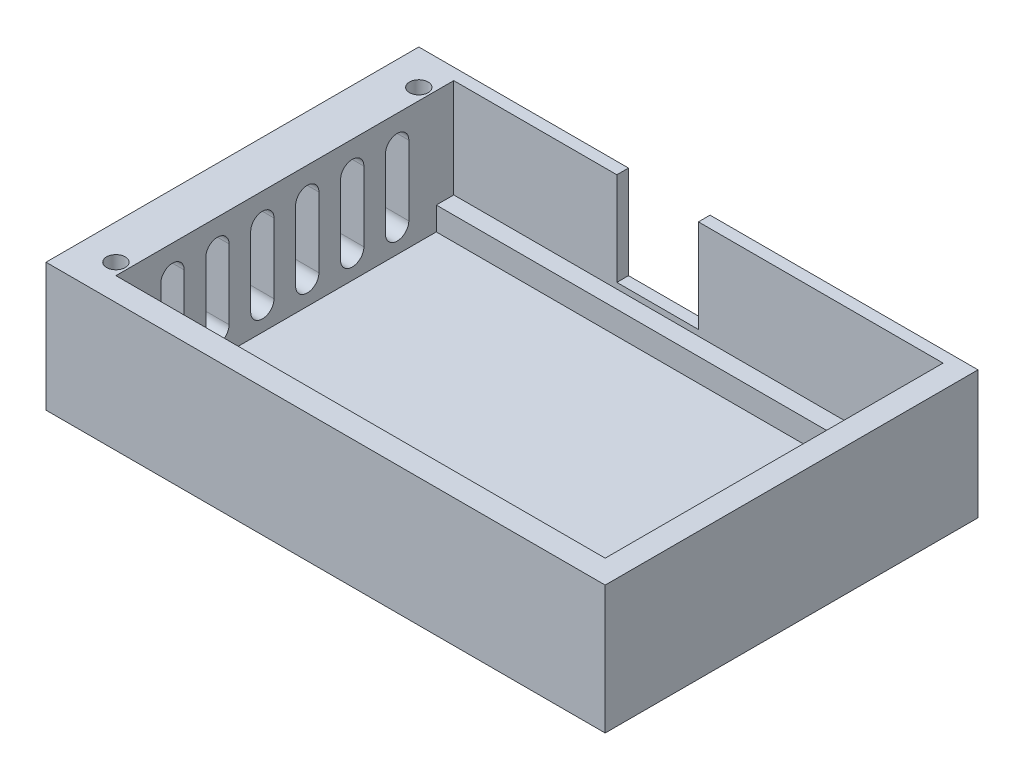
from build123d import *

# Parameters (mm, degrees)
SKETCH1_W                      = 96
SKETCH1_H                      = 64
BOSS_EXTRUDE1_DEPTH            = 1
SKETCH2_W                      = 96
SKETCH2_H                      = 64
SKETCH2_W_2                    = 72
SKETCH2_H_2                    = 52
BOSS_EXTRUDE2_DEPTH            = 21
SKETCH3_W                      = 72
SKETCH3_H                      = 3
BOSS_EXTRUDE3_DEPTH            = 4
SKETCH4_W                      = 72
SKETCH4_H                      = 6
CUT_EXTRUDE1_DEPTH             = 14
SKETCH5_W                      = 6
SKETCH5_H                      = 16
CUT_EXTRUDE2_DEPTH             = 60.363288319
CUT_EXTRUDE3_REACH             = 84.97
SKETCH6_W                      = 14
SKETCH6_H                      = 16
CUT_EXTRUDE3_DIRECTION_2_DEPTH = 83.969874051
SKETCH7_R                      = 1.6
CUT_EXTRUDE4_DEPTH             = 62.741396162
CUT_EXTRUDE5_DEPTH             = 8


with BuildPart() as part:
    # Sketch1 → Boss-Extrude1 (new body)
    with BuildSketch(Plane(origin=(0, 0, 0), x_dir=(1, 0, 0), z_dir=(0, 1, 0))):
        Rectangle(SKETCH1_W, SKETCH1_H)
    extrude(amount=BOSS_EXTRUDE1_DEPTH)

    # Sketch2 → Boss-Extrude2 (add)
    with BuildSketch(Plane(origin=(0, 1, 0), x_dir=(1, 0, 0), z_dir=(0, 1, 0))):
        Rectangle(SKETCH2_W, SKETCH2_H)
        with Locations((-4, 4)):
            Rectangle(SKETCH2_W_2, SKETCH2_H_2, mode=Mode.SUBTRACT)
    extrude(amount=BOSS_EXTRUDE2_DEPTH)

    # Sketch3 → Boss-Extrude3 (add)
    with BuildSketch(Plane(origin=(0, 1, 0), x_dir=(1, 0, 0), z_dir=(0, 1, 0))):
        with Locations((-4, -20.5)):
            Rectangle(SKETCH3_W, SKETCH3_H)
        with Locations((-4, 28.5)):
            Rectangle(SKETCH3_W, SKETCH3_H)
    extrude(amount=BOSS_EXTRUDE3_DEPTH)

    # Sketch4 → Cut-Extrude1 (cut)
    with BuildSketch(Plane(origin=(0, 22, 0), x_dir=(1, 0, 0), z_dir=(0, 1, 0))):
        Polygon((44, 30), (44, -28), (32, -28), (32, -22), (32, 30), align=None)
        with Locations((-4, -25)):
            Rectangle(SKETCH4_W, SKETCH4_H)
    extrude(amount=-CUT_EXTRUDE1_DEPTH, mode=Mode.SUBTRACT)

    # Sketch5 → Cut-Extrude2 (cut, through all)
    with BuildSketch(Plane(origin=(0, 8, 0), x_dir=(1, 0, 0), z_dir=(0, 1, 0))):
        with Locations((41, -20)):
            Rectangle(SKETCH5_W, SKETCH5_H)
    extrude(amount=-CUT_EXTRUDE2_DEPTH, mode=Mode.SUBTRACT)

    # Sketch6 → Cut-Extrude3 (cut, up to next)
    with BuildSketch(Plane(origin=(0, 0, -32), x_dir=(-1, 0, 0), z_dir=(0, 0, -1)), mode=Mode.PRIVATE) as cut_extrude3_sk1:
        with Locations((5, 14)):
            Rectangle(SKETCH6_W, SKETCH6_H)
    cut_extrude3_tool1 = extrude(cut_extrude3_sk1.sketch, amount=-CUT_EXTRUDE3_REACH, mode=Mode.PRIVATE) & part.part
    add(cut_extrude3_tool1.solids().sort_by_distance((-5, 14, -32))[0], mode=Mode.SUBTRACT)

    # Sketch6 → Cut-Extrude3 direction 2 (cut)
    with BuildSketch(Plane(origin=(0, 0, -32), x_dir=(-1, 0, 0), z_dir=(0, 0, -1))):
        with Locations((5, 14)):
            Rectangle(SKETCH6_W, SKETCH6_H)
    extrude(amount=CUT_EXTRUDE3_DIRECTION_2_DEPTH, mode=Mode.SUBTRACT)

    # Sketch7 → Cut-Extrude4 (cut, through all)
    with BuildSketch(Plane(origin=(0, 22, 0), x_dir=(1, 0, 0), z_dir=(0, 1, 0))):
        with Locations(Location((-42, 26, 0), (0, 0, 270))):
            Circle(SKETCH7_R)
        with Locations(Location((-42, -26, 0), (0, 0, 90))):
            Circle(SKETCH7_R)
        with Locations(Location((42, 26, 0), (0, 0, 270))):
            Circle(SKETCH7_R)
        with Locations(Location((42, -4, 0), (0, 0, 270))):
            Circle(SKETCH7_R)
    extrude(amount=-CUT_EXTRUDE4_DEPTH, mode=Mode.SUBTRACT)

    # Sketch9 → Cut-Extrude5 (cut)
    with BuildSketch(Plane.ZY.offset(48)):
        with BuildLine():
            Line((-18.285714286, 17), (-18.285714286, 5))
            ThreePointArc((-18.285714286, 5), (-20.285714286, 3), (-22.285714286, 5))
            Line((-22.285714286, 5), (-22.285714286, 17))
            ThreePointArc((-22.285714286, 17), (-20.285714286, 19), (-18.285714286, 17))
        make_face()
        with BuildLine():
            Line((-10.571428571, 17), (-10.571428571, 5))
            ThreePointArc((-10.571428571, 5), (-12.571428571, 3), (-14.571428571, 5))
            Line((-14.571428571, 5), (-14.571428571, 17))
            ThreePointArc((-14.571428571, 17), (-12.571428571, 19), (-10.571428571, 17))
        make_face()
        with BuildLine():
            Line((-2.857142857, 17), (-2.857142857, 5))
            ThreePointArc((-2.857142857, 5), (-4.857142857, 3), (-6.857142857, 5))
            Line((-6.857142857, 5), (-6.857142857, 17))
            ThreePointArc((-6.857142857, 17), (-4.857142857, 19), (-2.857142857, 17))
        make_face()
        with BuildLine():
            Line((4.857142857, 17), (4.857142857, 5))
            ThreePointArc((4.857142857, 5), (2.857142857, 3), (0.857142857, 5))
            Line((0.857142857, 5), (0.857142857, 17))
            ThreePointArc((0.857142857, 17), (2.857142857, 19), (4.857142857, 17))
        make_face()
        with BuildLine():
            Line((12.571428571, 17), (12.571428571, 5))
            ThreePointArc((12.571428571, 5), (10.571428571, 3), (8.571428571, 5))
            Line((8.571428571, 5), (8.571428571, 17))
            ThreePointArc((8.571428571, 17), (10.571428571, 19), (12.571428571, 17))
        make_face()
        with BuildLine():
            Line((20.285714286, 17), (20.285714286, 5))
            ThreePointArc((20.285714286, 5), (18.285714286, 3), (16.285714286, 5))
            Line((16.285714286, 5), (16.285714286, 17))
            ThreePointArc((16.285714286, 17), (18.285714286, 19), (20.285714286, 17))
        make_face()
    extrude(amount=-CUT_EXTRUDE5_DEPTH, mode=Mode.SUBTRACT)


solid = part.part
